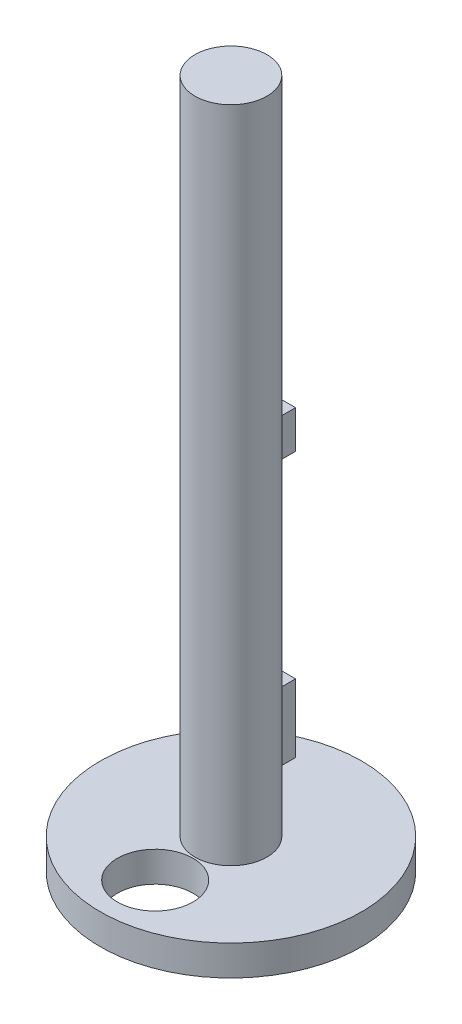
from build123d import *

# Parameters (mm, degrees)
SKETCH1_R           = 4.75
BOSS_EXTRUDE1_DEPTH = 87
SKETCH2_R           = 17.25
BOSS_EXTRUDE2_DEPTH = 4
SKETCH3_R           = 5
CUT_EXTRUDE1_DEPTH  = 4
BOSS_EXTRUDE3_START = 6.5
SKETCH4_W           = 3.5
SKETCH4_H           = 6.777720856
BOSS_EXTRUDE3_DEPTH = 9
BOSS_EXTRUDE4_START = 41.5
SKETCH5_W           = 3.5
SKETCH5_H           = 6.777720856
BOSS_EXTRUDE4_DEPTH = 5


with BuildPart() as part:
    # Sketch1 → Boss-Extrude1 (new body)
    with BuildSketch(Plane(origin=(0, 0, 0), x_dir=(1, 0, 0), z_dir=(0, 1, 0))):
        with Locations(Location((0, 0, 0), (0, 0, 270))):
            Circle(SKETCH1_R)
    extrude(amount=BOSS_EXTRUDE1_DEPTH)

    # Sketch2 → Boss-Extrude2 (add)
    with BuildSketch(Plane(origin=(0, 0, 0), x_dir=(-1, 0, 0), z_dir=(0, -1, 0))):
        with Locations(Location((0, 0, 0), (0, 0, 90))):
            Circle(SKETCH2_R)
    extrude(amount=BOSS_EXTRUDE2_DEPTH)

    # Sketch3 → Cut-Extrude1 (cut)
    with BuildSketch(Plane.XZ.offset(4)):
        with Locations(Location((0, 10, 0), (0, 0, 270))):
            Circle(SKETCH3_R)
    extrude(amount=-CUT_EXTRUDE1_DEPTH, mode=Mode.SUBTRACT)

    # Sketch4 → Boss-Extrude3 (add)
    with BuildSketch(Plane(origin=(0, 0, 0), x_dir=(1, 0, 0), z_dir=(0, 1, 0)).offset(BOSS_EXTRUDE3_START)):
        with Locations((0, 3.388860428)):
            Rectangle(SKETCH4_W, SKETCH4_H)
    extrude(amount=BOSS_EXTRUDE3_DEPTH)

    # Sketch5 → Boss-Extrude4 (add)
    with BuildSketch(Plane(origin=(0, 0, 0), x_dir=(1, 0, 0), z_dir=(0, 1, 0)).offset(BOSS_EXTRUDE4_START)):
        with Locations((0, 3.388860428)):
            Rectangle(SKETCH5_W, SKETCH5_H)
    extrude(amount=BOSS_EXTRUDE4_DEPTH)


solid = part.part
